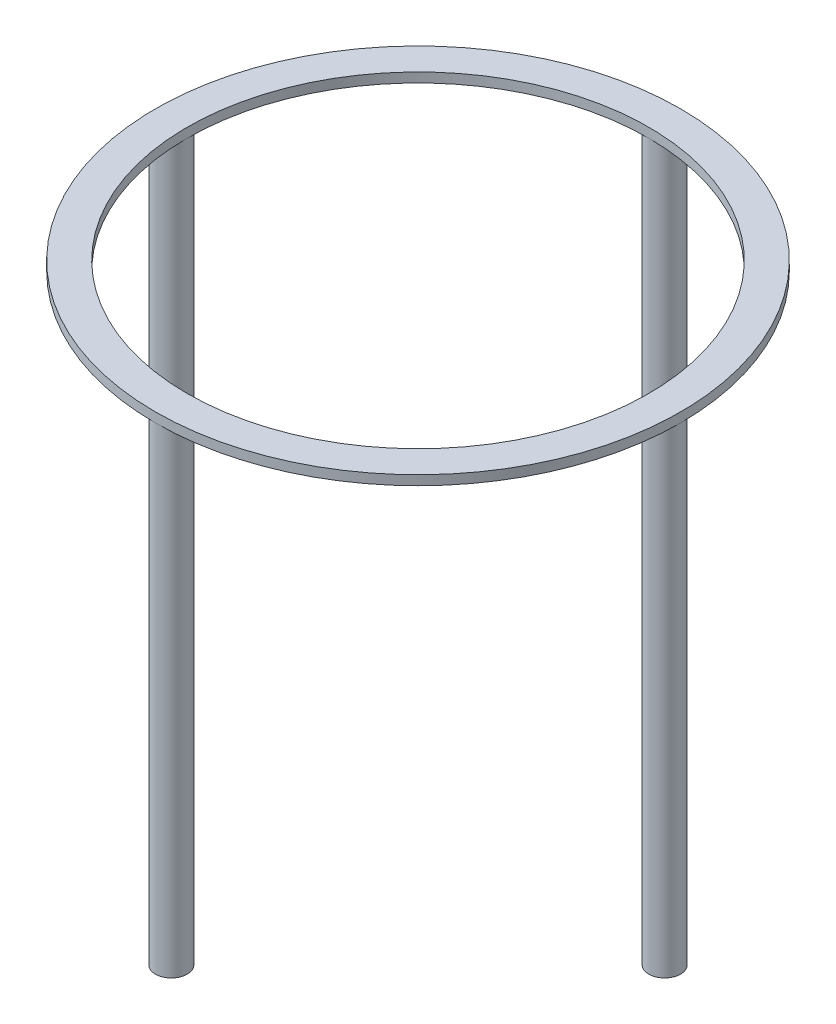
from build123d import *

# Parameters (mm, degrees)
SKETCH1_R           = 82.5
SKETCH1_R_2         = 72.5
BOSS_EXTRUDE1_DEPTH = 3
SKETCH2_R           = 5
BOSS_EXTRUDE2_DEPTH = 150


with BuildPart() as part:
    # Sketch1 → Boss-Extrude1 (new body)
    with BuildSketch(Plane(origin=(0, 0, 0), x_dir=(1, 0, 0), z_dir=(0, 1, 0))):
        Circle(SKETCH1_R)
        Circle(SKETCH1_R_2, mode=Mode.SUBTRACT)
    extrude(amount=BOSS_EXTRUDE1_DEPTH)

    # Sketch2 → Boss-Extrude2 (add)
    with BuildSketch(Plane(origin=(0, 0, 0), x_dir=(1, 0, 0), z_dir=(0, 1, 0))):
        with Locations((-77.5, 0)):
            Circle(SKETCH2_R)
        with Locations((0, -77.5)):
            Circle(SKETCH2_R)
        with Locations((77.5, 0)):
            Circle(SKETCH2_R)
        with Locations((0, 77.5)):
            Circle(SKETCH2_R)
    extrude(amount=-BOSS_EXTRUDE2_DEPTH)


solid = part.part
